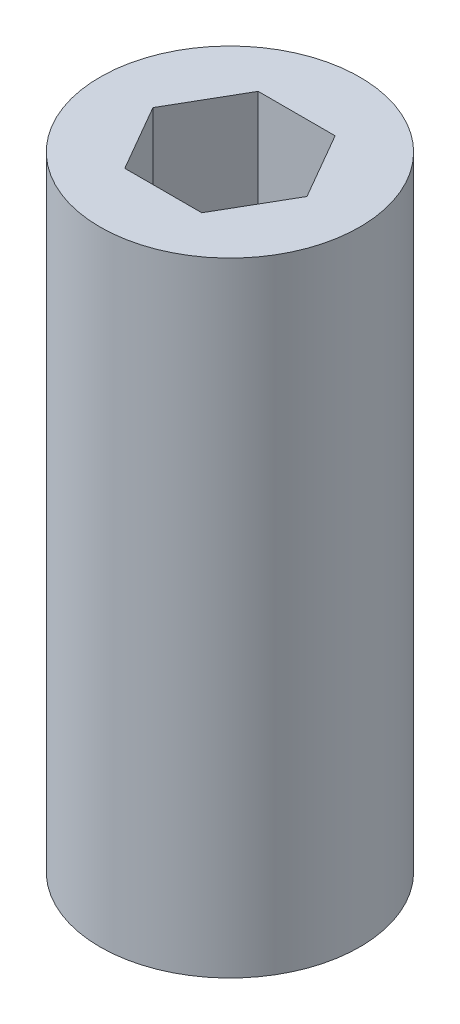
from build123d import *

# Parameters (mm, degrees)
SKETCH1_R           = 9.525
BOSS_EXTRUDE1_DEPTH = 45.72


with BuildPart() as part:
    # Sketch1 → Boss-Extrude1 (new body)
    with BuildSketch(Plane(origin=(0, 0, 0), x_dir=(1, 0, 0), z_dir=(0, 1, 0))):
        with Locations(Location((0, 0, 0), (0, 0, 270))):
            Circle(SKETCH1_R)
        Polygon((5.645908282, 0), (2.822954141, 4.8895), (-2.822954141, 4.8895), (-5.645908282, 0), (-2.822954141, -4.8895), (2.822954141, -4.8895), align=None, mode=Mode.SUBTRACT)
    extrude(amount=BOSS_EXTRUDE1_DEPTH)


solid = part.part
